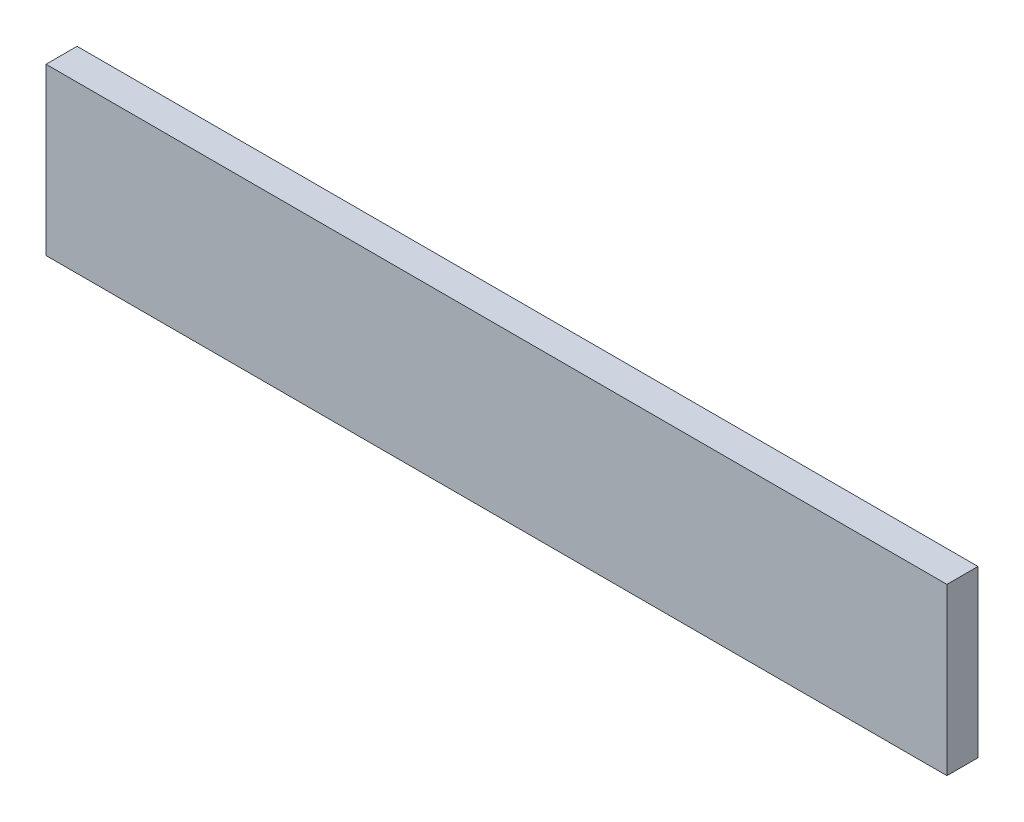
from build123d import *

# Parameters (mm, degrees)
SKETCH1_W           = 552.45
SKETCH1_H           = 101.6
BOSS_EXTRUDE1_DEPTH = 19.05


with BuildPart() as part:
    # Sketch1 → Boss-Extrude1 (new body)
    with BuildSketch(Plane.XY):
        Rectangle(SKETCH1_W, SKETCH1_H)
    extrude(amount=-BOSS_EXTRUDE1_DEPTH)


solid = part.part
